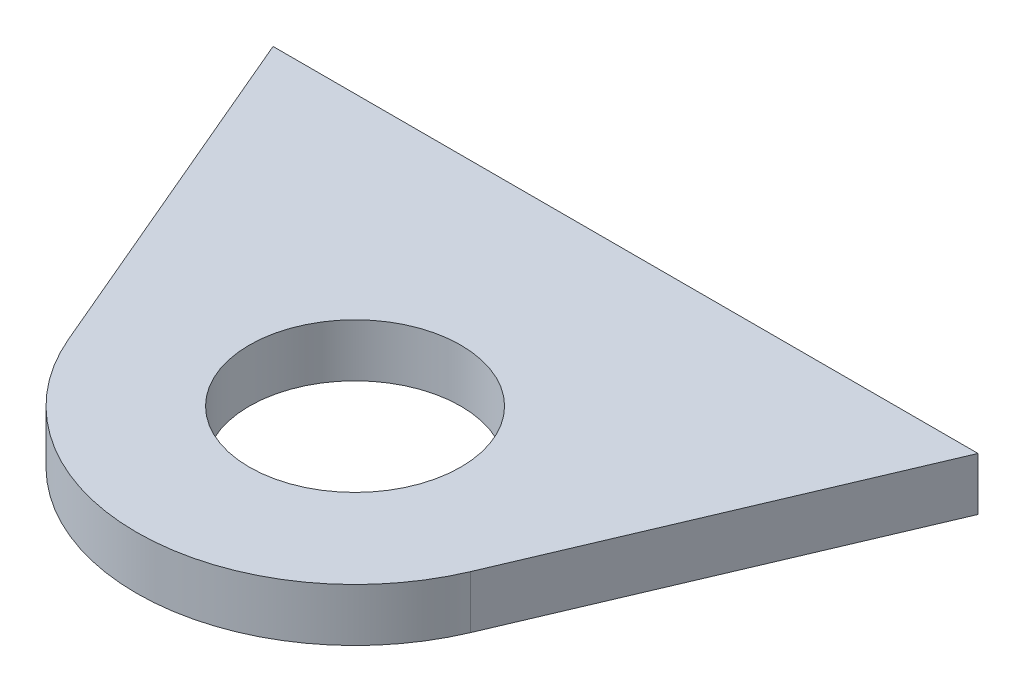
from build123d import *

# Parameters (mm, degrees)
SKETCH1_R           = 6
BOSS_EXTRUDE1_DEPTH = 3


with BuildPart() as part:
    # Sketch1 → Boss-Extrude1 (new body)
    with BuildSketch(Plane(origin=(0, 0, 0), x_dir=(1, 0, 0), z_dir=(0, 1, 0))):
        with BuildLine():
            Line((-20, 15.348123269), (20, 15.348123269))
            Line((20, 15.348123269), (11.411364412, -4.85188234))
            ThreePointArc((11.411364412, -4.85188234), (0, -12.4), (-11.411364412, -4.85188234))
            Line((-11.411364412, -4.85188234), (-20, 15.348123269))
        make_face()
        with Locations(Location((0, 0, 0), (0, 0, 270))):
            Circle(SKETCH1_R, mode=Mode.SUBTRACT)
    extrude(amount=BOSS_EXTRUDE1_DEPTH)


solid = part.part
